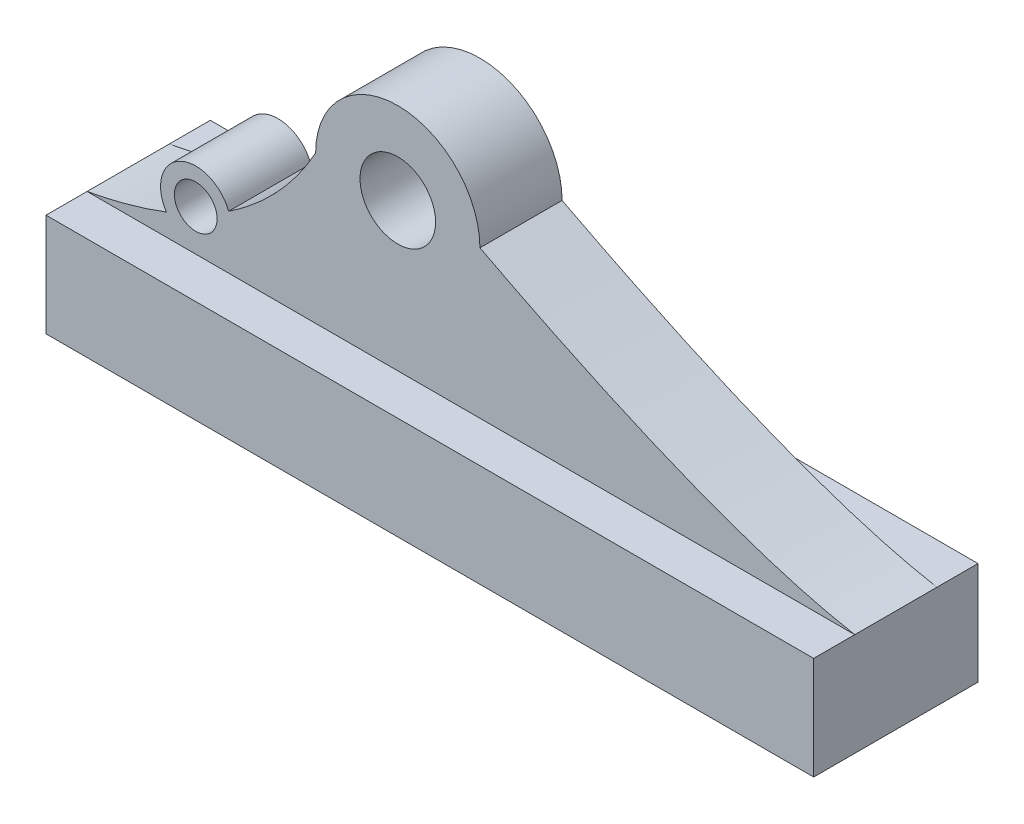
from build123d import *

# Parameters (mm, degrees)
SKETCH1_R               = 1.15
BOSS_EXTRUDE1_DEPTH     = 1.25
SKETCH2_W               = 23.360657125
SKETCH2_H               = 3.127548608
BOSS_EXTRUDE2_DEPTH     = 2.5
SKETCH3_R               = 1.070838979
BOSS_EXTRUDE3_DEPTH     = 2.5
CUT_EXTRUDE1_DEPTH      = 17.966509656
CUT_EXTRUDE1_DEPTH_BACK = 17.966509656
SKETCH4_R               = 0.65


with BuildPart() as part:
    # Sketch1 → Boss-Extrude1 (new, symmetric)
    with BuildSketch(Plane.XY):
        with BuildLine():
            Line((-10.268002202, 0), (13.092654923, 0))
            Line((13.092654923, 0), (13.092654923, 3.127548608))
            add(Edge.make_bspline(
                [(1.686549766, 7.618415505), (8.886011908, 3.875396255), (13.092654923, 3.127548608)],
                knots=[0, 0, 0, 1, 1, 1], degree=2))
            ThreePointArc((1.686549766, 7.618415505), (-0.813450234, 10.118415505), (-3.313450234, 7.618415505))
            add(Edge.make_bspline(
                [(-10.268002202, 3.127548608), (-5.306289346, 4.030602712), (-3.313450234, 7.618415505)],
                knots=[0, 0, 0, 1, 1, 1], degree=2))
            Line((-10.268002202, 3.127548608), (-10.268002202, 0))
        make_face()
        with Locations((-0.813450234, 7.618415505)):
            Circle(SKETCH1_R, mode=Mode.SUBTRACT)
    extrude(amount=BOSS_EXTRUDE1_DEPTH, both=True)

    # Sketch2 → Boss-Extrude2 (add, symmetric)
    with BuildSketch(Plane.XY):
        with Locations((1.412326361, 1.563774304)):
            Rectangle(SKETCH2_W, SKETCH2_H)
    extrude(amount=BOSS_EXTRUDE2_DEPTH, both=True)

    # Sketch3 → Boss-Extrude3 (add)
    with BuildSketch(Plane(origin=(0, 0, -1.25), x_dir=(-1, 0, 0), z_dir=(0, 0, -1))):
        with Locations((6.96167169, 4.380964726)):
            Circle(SKETCH3_R)
    extrude(amount=-BOSS_EXTRUDE3_DEPTH)

    # Sketch4 → Cut-Extrude1 (cut, two sides: drawn at the far end of the back side and taken through both)
    with BuildSketch(Plane(origin=(0, 0, -1.25), x_dir=(-1, 0, 0), z_dir=(0, 0, -1)).offset(-CUT_EXTRUDE1_DEPTH_BACK)):
        with Locations((6.96167169, 4.380964726)):
            Circle(SKETCH4_R)
    extrude(amount=CUT_EXTRUDE1_DEPTH + CUT_EXTRUDE1_DEPTH_BACK, mode=Mode.SUBTRACT)


with BuildPart() as part_1:
    # Body-Move/Copy1: moved
    add(part.part.moved(Location((0.81, -7.62, 0))))


solid = part_1.part
